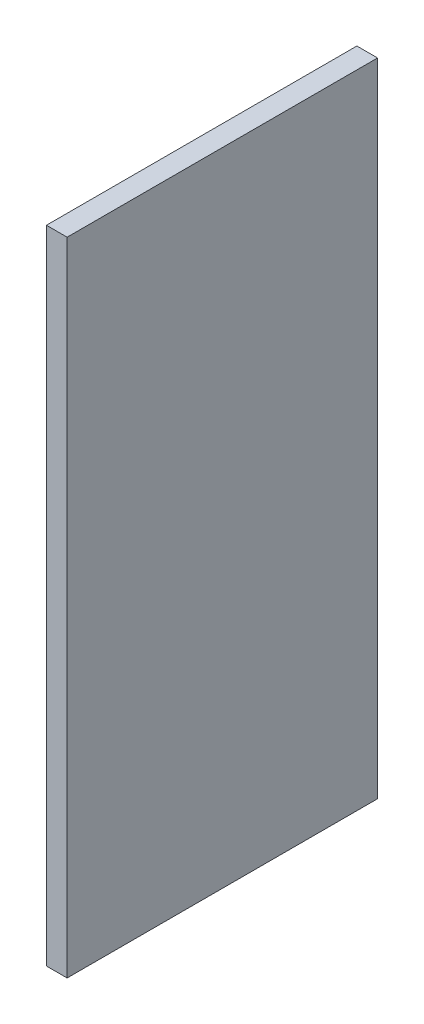
from build123d import *

# Parameters (mm, degrees)
SKETCH1_W           = 12.7
SKETCH1_H           = 190.5
BOSS_EXTRUDE1_DEPTH = 393.7


with BuildPart() as part:
    # Sketch1 → Boss-Extrude1 (new body)
    with BuildSketch(Plane(origin=(0, 0, 0), x_dir=(1, 0, 0), z_dir=(0, 1, 0))):
        with Locations((6.35, 95.25)):
            Rectangle(SKETCH1_W, SKETCH1_H)
    extrude(amount=BOSS_EXTRUDE1_DEPTH)


solid = part.part
